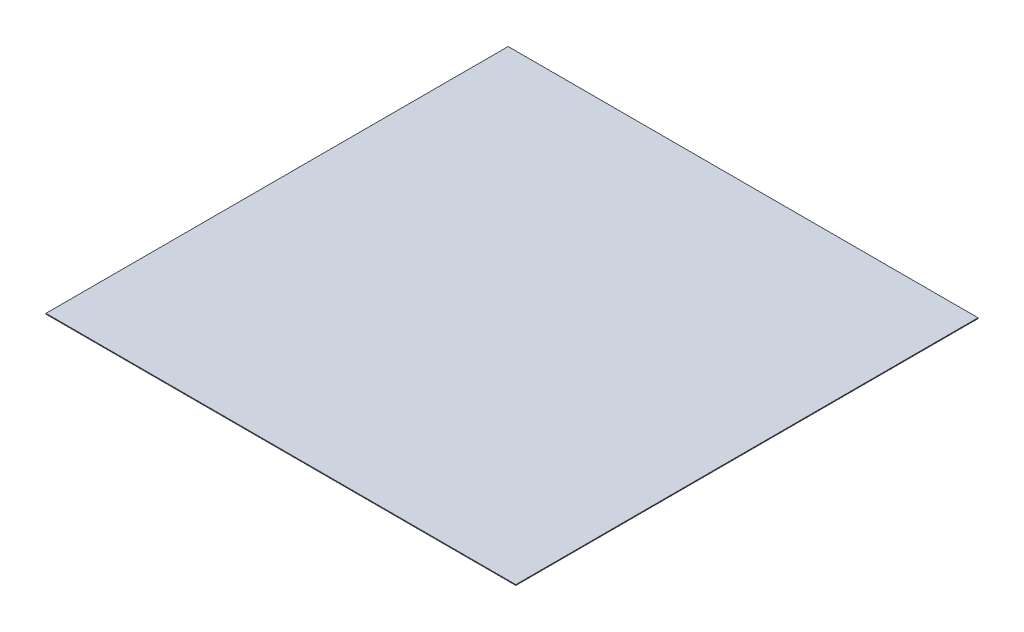
from build123d import *

# Parameters (mm, degrees)
SKETCH1_W           = 1220
SKETCH1_H           = 1200
BOSS_EXTRUDE1_DEPTH = 2


with BuildPart() as part:
    # Sketch1 → Boss-Extrude1 (new body)
    with BuildSketch(Plane(origin=(0, 0, 0), x_dir=(1, 0, 0), z_dir=(0, 1, 0))):
        Rectangle(SKETCH1_W, SKETCH1_H)
    extrude(amount=BOSS_EXTRUDE1_DEPTH)


solid = part.part
